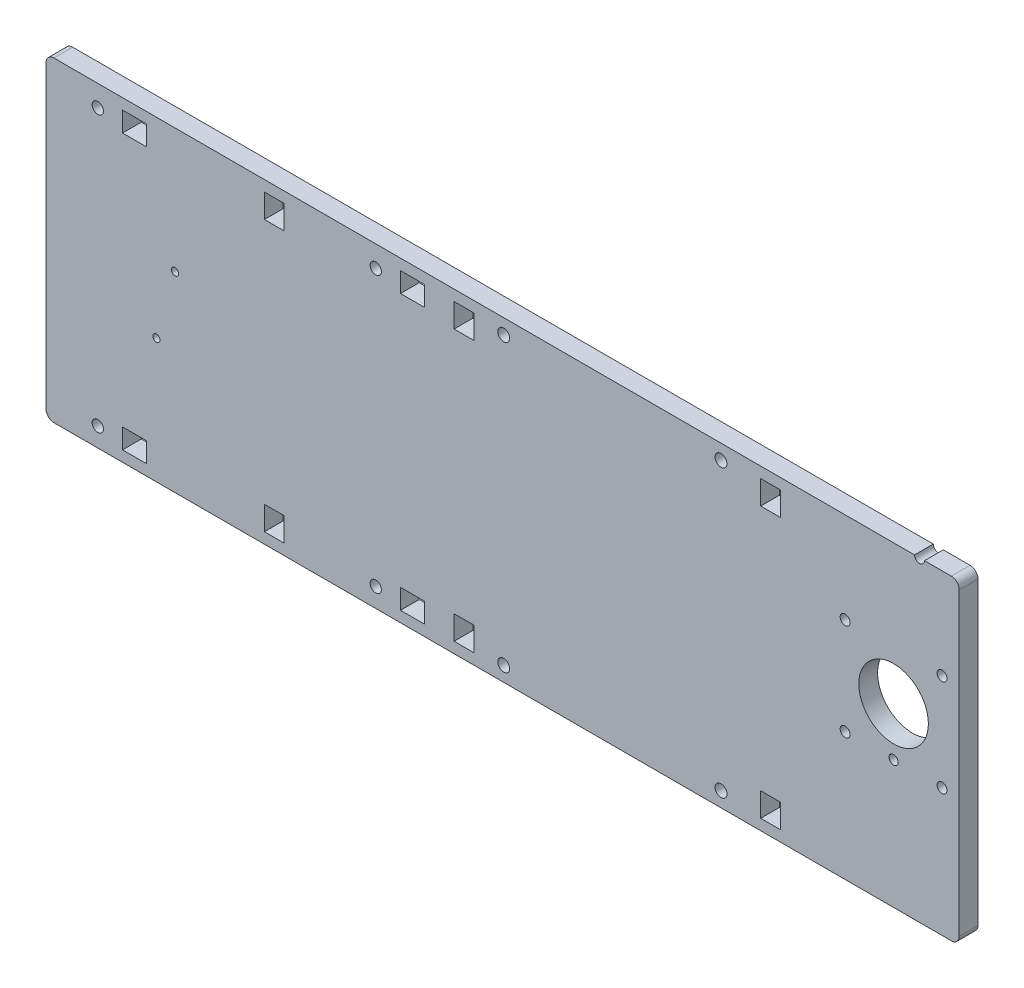
from build123d import *

# Parameters (mm, degrees)
SKETCH1_W           = 292.1
SKETCH1_H           = 101.0158
SKETCH1_W_2         = 6.35
SKETCH1_H_2         = 7.62
BOSS_EXTRUDE1_DEPTH = 6
SKETCH2_R           = 11.125
SKETCH2_R_2         = 1.5875
SKETCH2_R_3         = 1.4605
CUT_EXTRUDE1_DEPTH  = 310.132013628
SKETCH3_W           = 7.62
SKETCH3_H           = 6
CUT_EXTRUDE2_DEPTH  = 310.132013628
SKETCH4_W           = 7.62
SKETCH4_H           = 0.35
CUT_EXTRUDE3_DEPTH  = 6
FILLET1_R           = 2.54
SKETCH5_R           = 1.143
CUT_EXTRUDE4_DEPTH  = 310.132013628
SKETCH6_R           = 1.905
SKETCH6_W           = 6.35
SKETCH6_H           = 7.62
CUT_EXTRUDE5_DEPTH  = 310.132013628
SKETCH7_R           = 1.8034
CUT_EXTRUDE6_DEPTH  = 310.132013628
SKETCH8_R           = 1.5875
CUT_EXTRUDE7_DEPTH  = 310.132013628


with BuildPart() as part:
    # Sketch1 → Boss-Extrude1 (new body)
    with BuildSketch(Plane.XY):
        with Locations((146.05, 50.5079)):
            Rectangle(SKETCH1_W, SKETCH1_H)
        with Locations((231.775, 93.7514)):
            Rectangle(SKETCH1_W_2, SKETCH1_H_2, mode=Mode.SUBTRACT)
        with Locations((73.025, 93.7514)):
            Rectangle(SKETCH1_W_2, SKETCH1_H_2, mode=Mode.SUBTRACT)
        with Locations((231.775, 7.2644)):
            Rectangle(SKETCH1_W_2, SKETCH1_H_2, mode=Mode.SUBTRACT)
        with Locations((73.025, 7.2644)):
            Rectangle(SKETCH1_W_2, SKETCH1_H_2, mode=Mode.SUBTRACT)
    extrude(amount=BOSS_EXTRUDE1_DEPTH)

    # Sketch2 → Cut-Extrude1 (cut, through all)
    with BuildSketch(Plane.XY.offset(6)):
        with Locations((271.1, 56.4261)):
            Circle(SKETCH2_R)
        with Locations((255.6, 71.9261)):
            Circle(SKETCH2_R_2)
        with Locations((255.6, 40.9261)):
            Circle(SKETCH2_R_2)
        with Locations((286.6, 40.9261)):
            Circle(SKETCH2_R_2)
        with Locations((286.6, 71.9261)):
            Circle(SKETCH2_R_2)
        with Locations((271.1, 40.9261)):
            Circle(SKETCH2_R_3)
    extrude(amount=-CUT_EXTRUDE1_DEPTH, mode=Mode.SUBTRACT)

    # Sketch3 → Cut-Extrude2 (cut, through all)
    with BuildSketch(Plane.XY.offset(6)):
        with Locations((117.19, 94.5614)):
            Rectangle(SKETCH3_W, SKETCH3_H)
        with Locations((117.19, 6.4544)):
            Rectangle(SKETCH3_W, SKETCH3_H)
        with Locations((28.29, 6.4544)):
            Rectangle(SKETCH3_W, SKETCH3_H)
        with Locations((28.29, 94.5614)):
            Rectangle(SKETCH3_W, SKETCH3_H)
    extrude(amount=-CUT_EXTRUDE2_DEPTH, mode=Mode.SUBTRACT)

    # Sketch4 → Cut-Extrude3 (cut)
    with BuildSketch(Plane.XY.offset(6)):
        with Locations((28.29, 91.3864)):
            Rectangle(SKETCH4_W, SKETCH4_H)
        with Locations((28.29, 9.6294)):
            Rectangle(SKETCH4_W, SKETCH4_H)
        with Locations((117.19, 9.6294)):
            Rectangle(SKETCH4_W, SKETCH4_H)
        with Locations((117.19, 91.3864)):
            Rectangle(SKETCH4_W, SKETCH4_H)
    extrude(amount=-CUT_EXTRUDE3_DEPTH, mode=Mode.SUBTRACT)

    # Fillet1
    fillet1_edges = [part.edges().sort_by_distance(p)[0] for p in [
        (0, 101.0158, 3),
        (292.1, 101.0158, 3),
        (292.1, 0, 3),
        (0, 0, 3),
    ]]
    fillet(fillet1_edges, radius=FILLET1_R)

    # Sketch5 → Cut-Extrude4 (cut, through all)
    with BuildSketch(Plane.XY.offset(6)):
        with Locations((35.306, 39.824852294)):
            Circle(SKETCH5_R)
        with Locations((41.275, 61.190947706)):
            Circle(SKETCH5_R)
    extrude(amount=-CUT_EXTRUDE4_DEPTH, mode=Mode.SUBTRACT)

    # Sketch6 → Cut-Extrude5 (cut, through all)
    with BuildSketch(Plane.XY.offset(6)):
        with Locations((146.4, 96.2533)):
            Circle(SKETCH6_R)
        with Locations((215.9, 96.2533)):
            Circle(SKETCH6_R)
        with Locations((215.9, 4.7625)):
            Circle(SKETCH6_R)
        with Locations((146.4, 4.7625)):
            Circle(SKETCH6_R)
        with Locations((133.7, 93.7514)):
            Rectangle(SKETCH6_W, SKETCH6_H)
        with Locations((133.7, 7.2644)):
            Rectangle(SKETCH6_W, SKETCH6_H)
    extrude(amount=-CUT_EXTRUDE5_DEPTH, mode=Mode.SUBTRACT)

    # Sketch7 → Cut-Extrude6 (cut, through all)
    with BuildSketch(Plane.XY.offset(6)):
        with Locations((16.5679, 94.2114)):
            Circle(SKETCH7_R)
        with Locations((105.4679, 94.2114)):
            Circle(SKETCH7_R)
        with Locations((105.4679, 6.1044)):
            Circle(SKETCH7_R)
        with Locations((16.5679, 6.1044)):
            Circle(SKETCH7_R)
    extrude(amount=-CUT_EXTRUDE6_DEPTH, mode=Mode.SUBTRACT)

    # Sketch8 → Cut-Extrude7 (cut, through all)
    with BuildSketch(Plane.XY.offset(6)):
        with Locations((279.4, 101.0158)):
            Circle(SKETCH8_R)
    extrude(amount=-CUT_EXTRUDE7_DEPTH, mode=Mode.SUBTRACT)


solid = part.part
